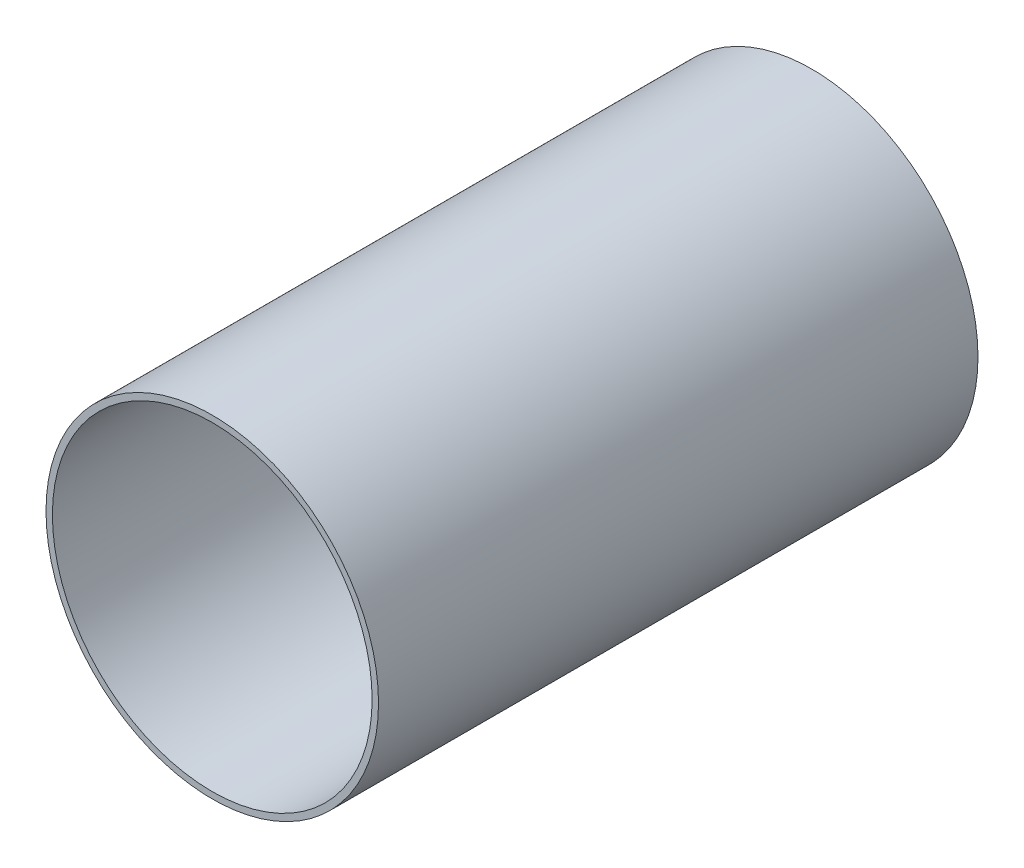
from build123d import *

# Parameters (mm, degrees)
SKETCH1_R           = 0.416
SKETCH1_R_2         = 0.4
BOSS_EXTRUDE1_DEPTH = 1.5


with BuildPart() as part:
    # Sketch1 → Boss-Extrude1 (new body)
    with BuildSketch(Plane.XY):
        Circle(SKETCH1_R)
        Circle(SKETCH1_R_2, mode=Mode.SUBTRACT)
    extrude(amount=BOSS_EXTRUDE1_DEPTH)


solid = part.part
